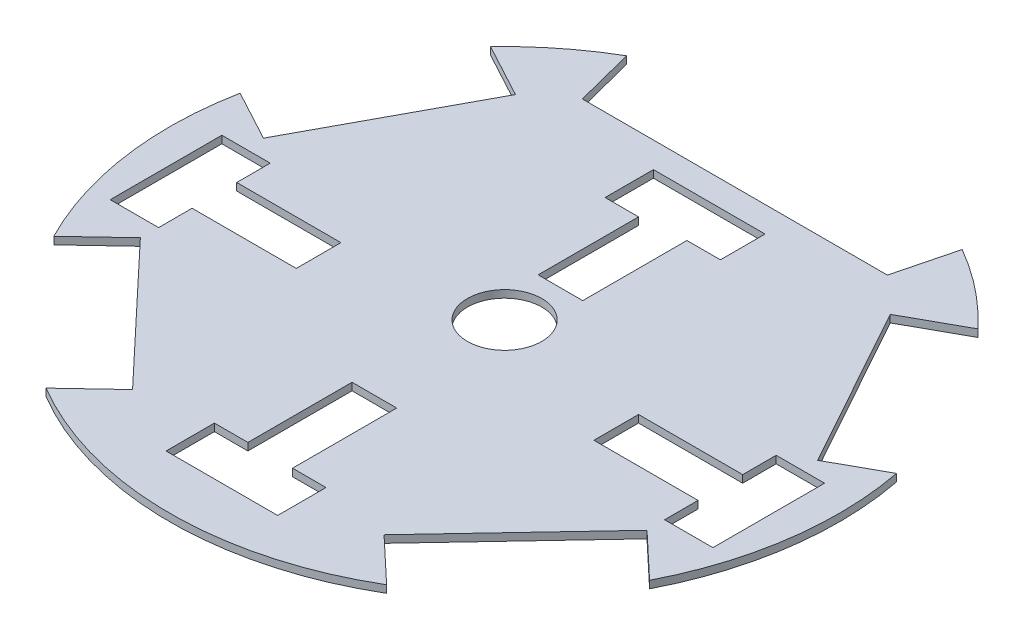
from build123d import *

# Parameters (mm, degrees)
SKETCH1_R           = 10
BOSS_EXTRUDE1_DEPTH = 2


with BuildPart() as part:
    # Sketch1 → Boss-Extrude1 (new body)
    with BuildSketch(Plane(origin=(0, 0, 0), x_dir=(1, 0, 0), z_dir=(0, 1, 0))):
        with BuildLine():
            Line((74.750839635, 9.397976908), (62.630621153, 31.263481795))
            Line((62.630621153, 31.263481795), (50.510402672, 53.128986682))
            Line((50.510402672, 53.128986682), (65.676291813, 61.535556337))
            ThreePointArc((65.676291813, 61.535556337), (55.986333501, 70.466520143), (45.096073772, 77.886739118))
            Line((45.096073772, 77.886739118), (41, 61.886739118))
            Line((41, 61.886739118), (0, 61.886739118))
            Line((0, 61.886739118), (-41, 61.886739118))
            Line((-41, 61.886739118), (-45.096073772, 77.886739118))
            ThreePointArc((-45.096073772, 77.886739118), (-55.882783617, 70.548667565), (-65.495262312, 61.728199509))
            Line((-65.495262312, 61.728199509), (-51.013470384, 53.925622849))
            Line((-51.013470384, 53.925622849), (-62.871489624, 31.916820526))
            Line((-62.871489624, 31.916820526), (-74.729508865, 9.908018203))
            Line((-74.729508865, 9.908018203), (-88.333788079, 17.237803909))
            ThreePointArc((-88.333788079, 17.237803909), (-89.109620692, -12.628360942), (-80.06590623, -41.102927627))
            Line((-80.06590623, -41.102927627), (-68.088543882, -29.815267766))
            Line((-68.088543882, -29.815267766), (-50.942469943, -48.009007032))
            Line((-50.942469943, -48.009007032), (-33.796396003, -66.202746297))
            Line((-33.796396003, -66.202746297), (-45.773758351, -77.490406158))
            ThreePointArc((-45.773758351, -77.490406158), (0, -90), (45.773758351, -77.490406158))
            Line((45.773758351, -77.490406158), (33.796396003, -66.202746297))
            Line((33.796396003, -66.202746297), (50.942469943, -48.009007032))
            Line((50.942469943, -48.009007032), (68.088543882, -29.815267766))
            Line((68.088543882, -29.815267766), (80.06590623, -41.102927627))
            ThreePointArc((80.06590623, -41.102927627), (87.481231018, -21.143183763), (90, 0))
            ThreePointArc((90, 0), (89.596114425, 8.516823346), (88.388082669, 16.957206202))
            Line((88.388082669, 16.957206202), (74.750839635, 9.397976908))
        make_face()
        Polygon((-68, 5), (-68, -4), (-40, -4), (-40, -16), (-68, -16), (-68, -25), (-81, -25), (-81, 5), align=None, mode=Mode.SUBTRACT)
        Polygon((-15, -63), (-6, -63), (-6, -35), (6, -35), (6, -63), (15, -63), (15, -76), (-15, -76), align=None, mode=Mode.SUBTRACT)
        Polygon((68, -25), (68, -16), (40, -16), (40, -4), (67.990906131, -4), (67.990906131, 5), (80.990906131, 5), (80.990906131, -25), align=None, mode=Mode.SUBTRACT)
        Polygon((15, 43), (6, 43), (6, 15), (-6, 15), (-6, 42), (-15, 42), (-15, 55), (15, 55), align=None, mode=Mode.SUBTRACT)
        with Locations(Location((0, 0, 0), (0, 0, 270))):
            Circle(SKETCH1_R, mode=Mode.SUBTRACT)
    extrude(amount=BOSS_EXTRUDE1_DEPTH)


solid = part.part
